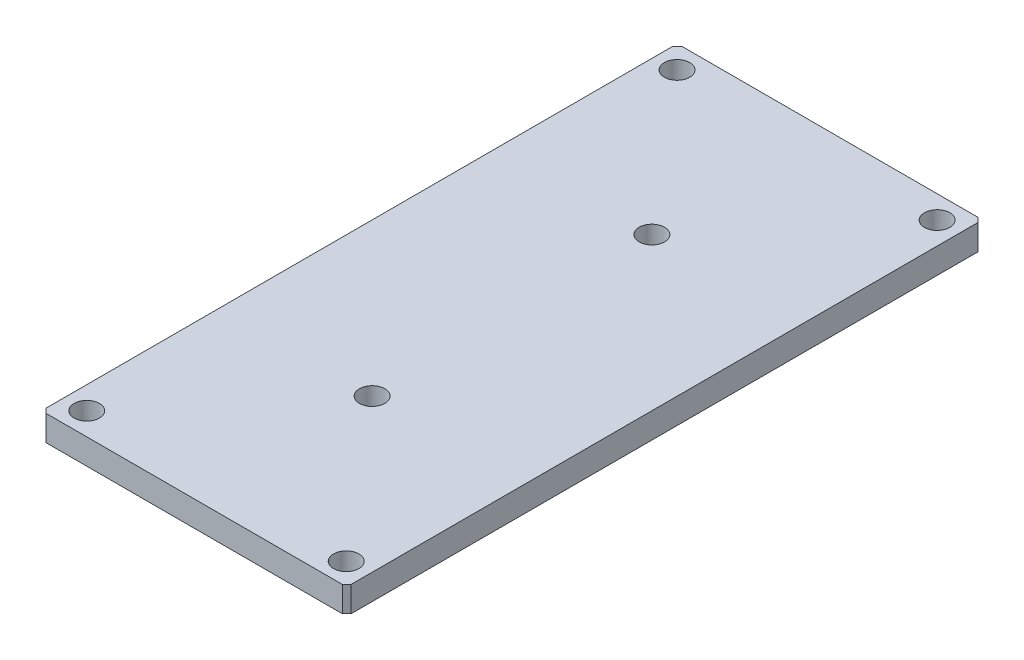
from build123d import *

# Parameters (mm, degrees)
SKETCH_1_W          = 24
SKETCH_1_H          = 50
SKETCH_1_R          = 1
EXTRUDE_1_DEPTH     = 2
SKETCH_2_R          = 1
CUT_EXTRUDE_2_DEPTH = 2
CUT_EXTRUDE_3_DEPTH = 2


with BuildPart() as part:
    # 草图1 → 凸台-拉伸1 (new body)
    with BuildSketch(Plane(origin=(0, 0, 0), x_dir=(1, 0, 0), z_dir=(0, 1, 0))):
        with Locations((-11.885843957, 49.208625632)):
            Rectangle(SKETCH_1_W, SKETCH_1_H)
        with Locations(Location((-11.885843957, 60.208625632, 0), (0, 0, 270))):
            Circle(SKETCH_1_R, mode=Mode.SUBTRACT)
    extrude(amount=EXTRUDE_1_DEPTH)

    # 草图2 → 切除-拉伸2 (cut)
    with BuildSketch(Plane(origin=(0, 2, 0), x_dir=(1, 0, 0), z_dir=(0, 1, 0))):
        with Locations(Location((-11.885843957, 38.208625632, 0), (0, 0, 270))):
            Circle(SKETCH_2_R)
        with Locations(Location((-22.109843957, 72.412625632, 0), (0, 0, 270))):
            Circle(SKETCH_2_R)
        with Locations(Location((-1.655843957, 72.412625632, 0), (0, 0, 270))):
            Circle(SKETCH_2_R)
        with Locations(Location((-22.107843957, 25.986625632, 0), (0, 0, 270))):
            Circle(SKETCH_2_R)
        with Locations(Location((-1.655843957, 25.938625632, 0), (0, 0, 270))):
            Circle(SKETCH_2_R)
    extrude(amount=-CUT_EXTRUDE_2_DEPTH, mode=Mode.SUBTRACT)

    # 草图3 → 切除-拉伸3 (cut)
    with BuildSketch(Plane(origin=(0, 2, 0), x_dir=(1, 0, 0), z_dir=(0, 1, 0))):
        Polygon((-23.885843957, 74.208625632), (-23.535843957, 74.208625632), (-23.885843957, 73.858625632), align=None)
        Polygon((0.114156043, 74.208625632), (0.114156043, 73.858625632), (-0.235843957, 74.208625632), align=None)
        Polygon((0.114156043, 24.208625632), (-0.235843957, 24.208625632), (0.114156043, 24.558625632), align=None)
        Polygon((-23.885843957, 24.208625632), (-23.535843957, 24.208625632), (-23.885843957, 24.558625632), align=None)
    extrude(amount=-CUT_EXTRUDE_3_DEPTH, mode=Mode.SUBTRACT)


solid = part.part
